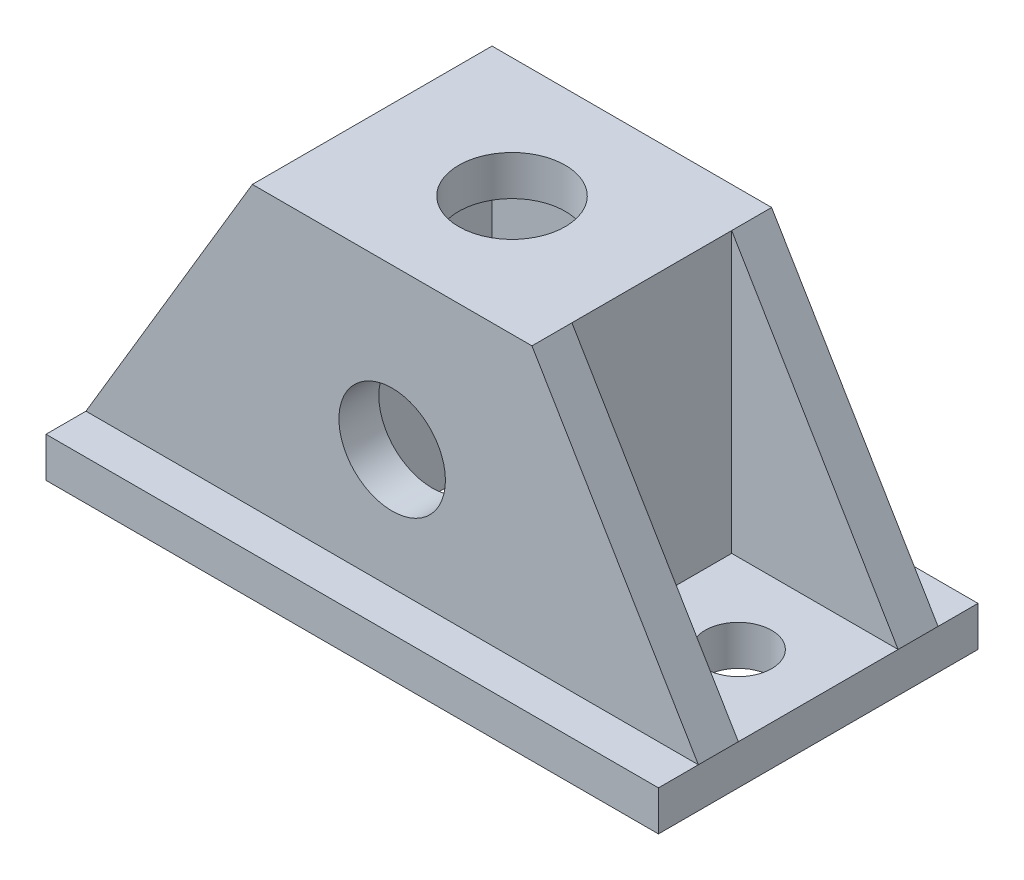
from build123d import *

# Parameters (mm, degrees)
SCHIZZO1_W                   = 92
SCHIZZO1_H                   = 48
SCHIZZO1_W_2                 = 30
SCHIZZO1_H_2                 = 24
ESTRUSIONE_ESTRUSIONE1_DEPTH = 6
SCHIZZO2_W                   = 42
SCHIZZO2_H                   = 36
SCHIZZO2_W_2                 = 30
SCHIZZO2_H_2                 = 24
ESTRUSIONE_ESTRUSIONE2_DEPTH = 36
SCHIZZO3_W                   = 42
SCHIZZO3_H                   = 36
ESTRUSIONE_ESTRUSIONE3_DEPTH = 6
ESTRUSIONE_ESTRUSIONE4_DEPTH = 6
FORO_16_0_16_1_D             = 16
FORO_16_0_16_2_D             = 16
FORO_10_0_10_1_D             = 10


with BuildPart() as part:
    # Schizzo1 → Estrusione-Estrusione1 (new body)
    with BuildSketch(Plane(origin=(0, 0, 0), x_dir=(1, 0, 0), z_dir=(0, 1, 0))):
        Rectangle(SCHIZZO1_W, SCHIZZO1_H)
        Rectangle(SCHIZZO1_W_2, SCHIZZO1_H_2, mode=Mode.SUBTRACT)
    extrude(amount=ESTRUSIONE_ESTRUSIONE1_DEPTH)

    # Schizzo2 → Estrusione-Estrusione2 (add)
    with BuildSketch(Plane(origin=(0, 6, 0), x_dir=(1, 0, 0), z_dir=(0, 1, 0))):
        Rectangle(SCHIZZO2_W, SCHIZZO2_H)
        Rectangle(SCHIZZO2_W_2, SCHIZZO2_H_2, mode=Mode.SUBTRACT)
    extrude(amount=ESTRUSIONE_ESTRUSIONE2_DEPTH)

    # Schizzo3 → Estrusione-Estrusione3 (add)
    with BuildSketch(Plane(origin=(0, 42, 0), x_dir=(1, 0, 0), z_dir=(0, 1, 0))):
        Rectangle(SCHIZZO3_W, SCHIZZO3_H)
    extrude(amount=ESTRUSIONE_ESTRUSIONE3_DEPTH)

    # Schizzo4 → Estrusione-Estrusione4 (add)
    with BuildSketch(Plane.XY.offset(18)):
        Polygon((-21, 48), (-46, 6), (-21, 6), align=None)
        Polygon((21, 48), (46, 6), (21, 6), align=None)
    estrusione_estrusione4 = extrude(amount=-ESTRUSIONE_ESTRUSIONE4_DEPTH)

    # Specchia1: Estrusione-Estrusione4 across plane
    add(estrusione_estrusione4.mirror(Plane.XY))

    # Foro Ø16.0 (16)-1 (through all)
    with Locations(Plane.XY.offset(18)):
        with Locations((0, 24)):
            Hole(FORO_16_0_16_1_D / 2)

    # Foro Ø16.0 (16)-2 (through all)
    with Locations(Plane(origin=(0, 48, 0), x_dir=(1, 0, 0), z_dir=(0, 1, 0))):
        with Locations((0, 0)):
            Hole(FORO_16_0_16_2_D / 2)

    # Foro Ø10.0 (10)-1 (through all)
    with Locations(Plane(origin=(0, 6, 0), x_dir=(1, 0, 0), z_dir=(0, 1, 0))):
        with Locations((-34, 0), (34, 0)):
            Hole(FORO_10_0_10_1_D / 2)


solid = part.part
